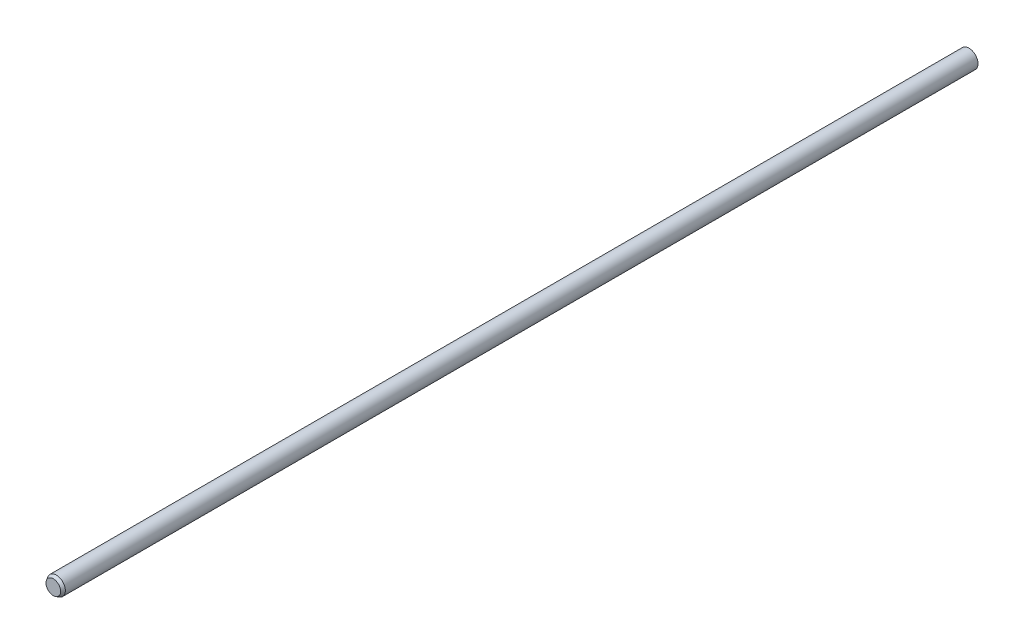
from build123d import *
from OCP.BRepFilletAPI import BRepFilletAPI_MakeChamfer

# Parameters (mm, degrees)
SKETCH1_R           = 3
BOSS_EXTRUDE1_DEPTH = 304
CHAMFER1_SIZE       = 1
CHAMFER1_SIZE2      = 0.577350269


with BuildPart() as part:
    # Sketch1 → Boss-Extrude1 (new body)
    with BuildSketch(Plane.XY):
        Circle(SKETCH1_R)
    extrude(amount=BOSS_EXTRUDE1_DEPTH)

    # Chamfer1: one chamfer whose edges measure the first distance from different faces: ONE call of the kernel's chamfer builder (chamfer() names one face for all edges)
    chamfer1_edges_1 = [part.edges().sort_by_distance(p)[0] for p in [
        (-3, 0, 0),
    ]]
    chamfer1_side_1 = [part.faces().sort_by_distance(p)[0] for p in [
        (0, 0, 0),
    ]]
    chamfer1_edges_2 = [part.edges().sort_by_distance(p)[0] for p in [
        (-3, 0, 304),
    ]]
    chamfer1_side_2 = [part.faces().sort_by_distance(p)[0] for p in [
        (-3, 0, 152),
    ]]
    chamfer1 = BRepFilletAPI_MakeChamfer(part.part.solid().wrapped)
    for e in chamfer1_edges_1:
        chamfer1.Add(CHAMFER1_SIZE, CHAMFER1_SIZE2, e.wrapped, chamfer1_side_1[0].wrapped)  # the first distance lies on this face
    for e in chamfer1_edges_2:
        chamfer1.Add(CHAMFER1_SIZE, CHAMFER1_SIZE2, e.wrapped, chamfer1_side_2[0].wrapped)  # the first distance lies on this face
    add(Compound.cast(chamfer1.Shape()), mode=Mode.REPLACE)


solid = part.part
